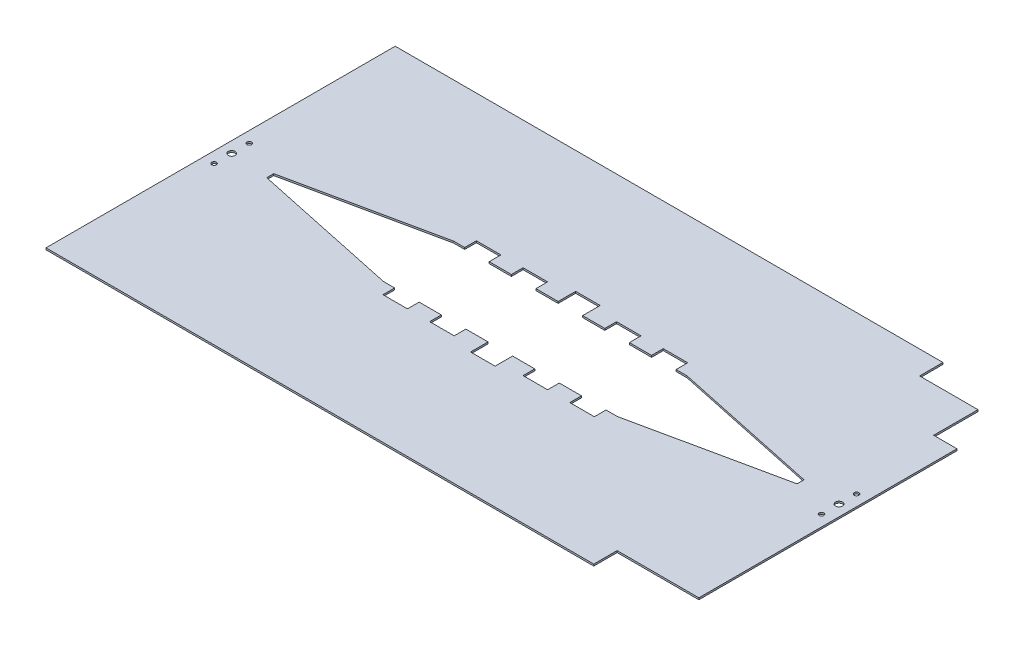
from build123d import *

# Parameters (mm, degrees)
SKETCH1_W           = 539
SKETCH1_H           = 299
BOSS_EXTRUDE1_DEPTH = 1.5
SKETCH10_W          = 70
SKETCH10_H          = 20
CUT_EXTRUDE6_DEPTH  = 309.192715683
SKETCH2_R           = 3
SKETCH2_R_2         = 2
CUT_EXTRUDE1_DEPTH  = 10
CUT_EXTRUDE7_DEPTH  = 309.192715683


with BuildPart() as part:
    # Sketch1 → Boss-Extrude1 (new body)
    with BuildSketch(Plane(origin=(0, 0, 0), x_dir=(1, 0, 0), z_dir=(0, 1, 0))):
        Rectangle(SKETCH1_W, SKETCH1_H)
    extrude(amount=-BOSS_EXTRUDE1_DEPTH)

    # Sketch10 → Cut-Extrude6 (cut, through all)
    with BuildSketch(Plane(origin=(0, 0, 0), x_dir=(1, 0, 0), z_dir=(0, 1, 0))):
        Polygon((269.5, 149.5), (199.5, 149.5), (199.5, 129.5), (249.5, 129.5), (249.5, 91.5), (269.5, 91.5), align=None)
        with Locations((234.5, -139.5)):
            Rectangle(SKETCH10_W, SKETCH10_H)
    extrude(amount=-CUT_EXTRUDE6_DEPTH, mode=Mode.SUBTRACT)

    # Sketch2 → Cut-Extrude1 (cut)
    with BuildSketch(Plane(origin=(0, 0, 0), x_dir=(1, 0, 0), z_dir=(0, 1, 0))):
        with Locations(Location((-260, 0, 0), (0, 0, 270))):
            Circle(SKETCH2_R)
        with Locations(Location((-260, 15, 0), (0, 0, 270))):
            Circle(SKETCH2_R_2)
        with Locations(Location((-260, -15, 0), (0, 0, 270))):
            Circle(SKETCH2_R_2)
    cut_extrude1 = extrude(amount=-CUT_EXTRUDE1_DEPTH, mode=Mode.SUBTRACT)

    # Mirror1: Cut-Extrude1 across plane
    add(cut_extrude1.mirror(Plane(origin=(0, 0, 0), x_dir=(0, 0, 1), z_dir=(1, 0, 0))), mode=Mode.SUBTRACT)

    # Sketch11 → Cut-Extrude7 (cut, through all)
    with BuildSketch(Plane(origin=(0, 0, 0), x_dir=(1, 0, 0), z_dir=(0, 1, 0))):
        Polygon((227.025012956, 3), (227.025012956, -3), (100, -30), (90.5, -30), (90.5, -40), (69.5, -40), (69.5, -30), (50.5, -30), (50.5, -40), (29.5, -40), (29.5, -30), (10.5, -30), (10.5, -45), (-10.5, -45), (-10.5, -30), (-29.5, -30), (-29.5, -40), (-50.5, -40), (-50.5, -30), (-69.5, -30), (-69.5, -40), (-90.5, -40), (-90.5, -30), (-100, -30), (-227.025012956, -3), (-227.025012956, 3), (-100, 30), (-90.5, 30), (-90.5, 40), (-69.5, 40), (-69.5, 30), (-50.5, 30), (-50.5, 40), (-29.5, 40), (-29.5, 30), (-10.5, 30), (-10.5, 45), (10.5, 45), (10.5, 30), (29.5, 30), (29.5, 40), (50.5, 40), (50.5, 30), (69.5, 30), (69.5, 40), (90.5, 40), (90.5, 30), (100, 30), align=None)
    extrude(amount=-CUT_EXTRUDE7_DEPTH, mode=Mode.SUBTRACT)


solid = part.part
